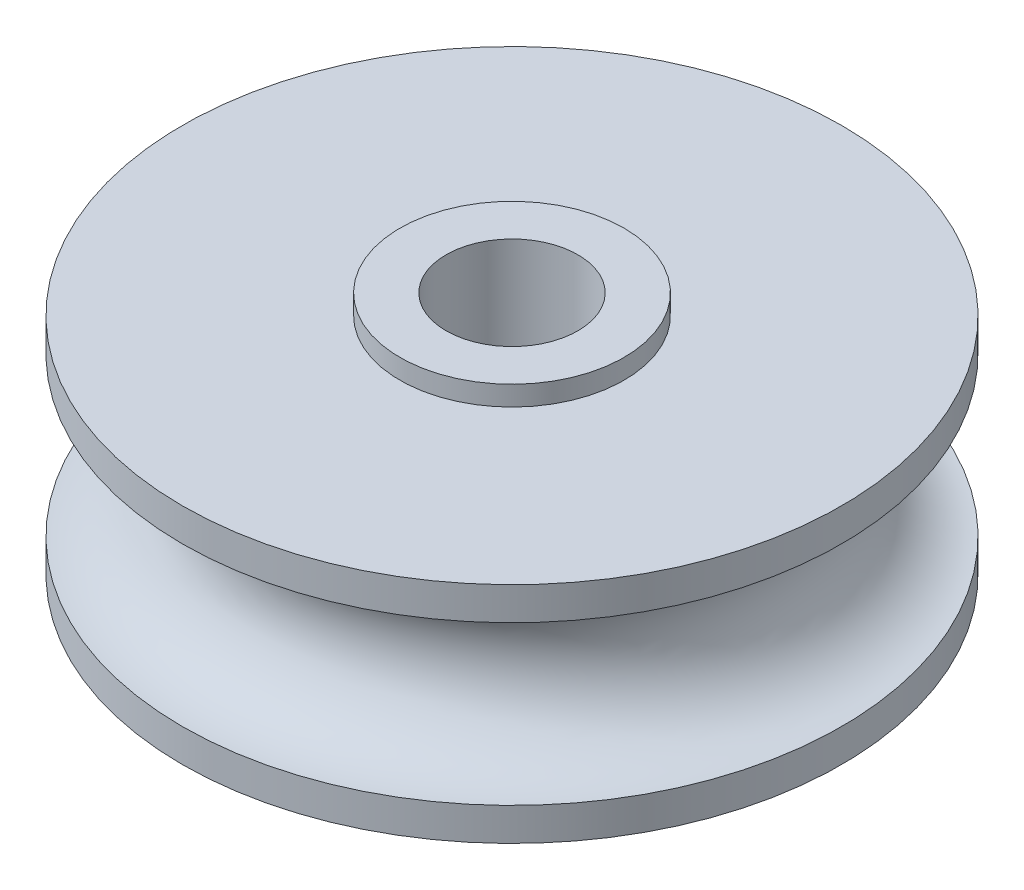
from build123d import *

# Parameters (mm, degrees)
SKETCH2_R          = 2.54
CUT_EXTRUDE1_DEPTH = 21.635057548


with BuildPart() as part:
    # Sketch1 → Revolve1 (revolve)
    with BuildSketch(Plane.XY, mode=Mode.PRIVATE) as revolve1_sk:
        with BuildLine():
            Line((0, 0), (0, 10.16))
            Line((0, 10.16), (4.318, 10.16))
            Line((4.318, 10.16), (4.318, 9.398))
            Line((4.318, 9.398), (12.7, 9.398))
            Line((12.7, 9.398), (12.7, 8.128))
            ThreePointArc((12.7, 8.128), (9.652, 5.08), (12.7, 2.032))
            Line((12.7, 2.032), (12.7, 0.762))
            Line((12.7, 0.762), (4.318, 0.762))
            Line((4.318, 0.762), (4.318, 0))
            Line((4.318, 0), (0, 0))
        make_face()
    revolve(revolve1_sk.sketch.rotate(Axis((0, 0, 0), (0, 1, 0)), 90), axis=Axis((0, 0, 0), (0, 1, 0)))

    # Sketch2 → Cut-Extrude1 (cut, through all)
    with BuildSketch(Plane(origin=(0, 10.16, 0), x_dir=(1, 0, 0), z_dir=(0, 1, 0))):
        with Locations(Location((0, 0, 0), (0, 0, 270))):
            Circle(SKETCH2_R)
    extrude(amount=-CUT_EXTRUDE1_DEPTH, mode=Mode.SUBTRACT)


solid = part.part
